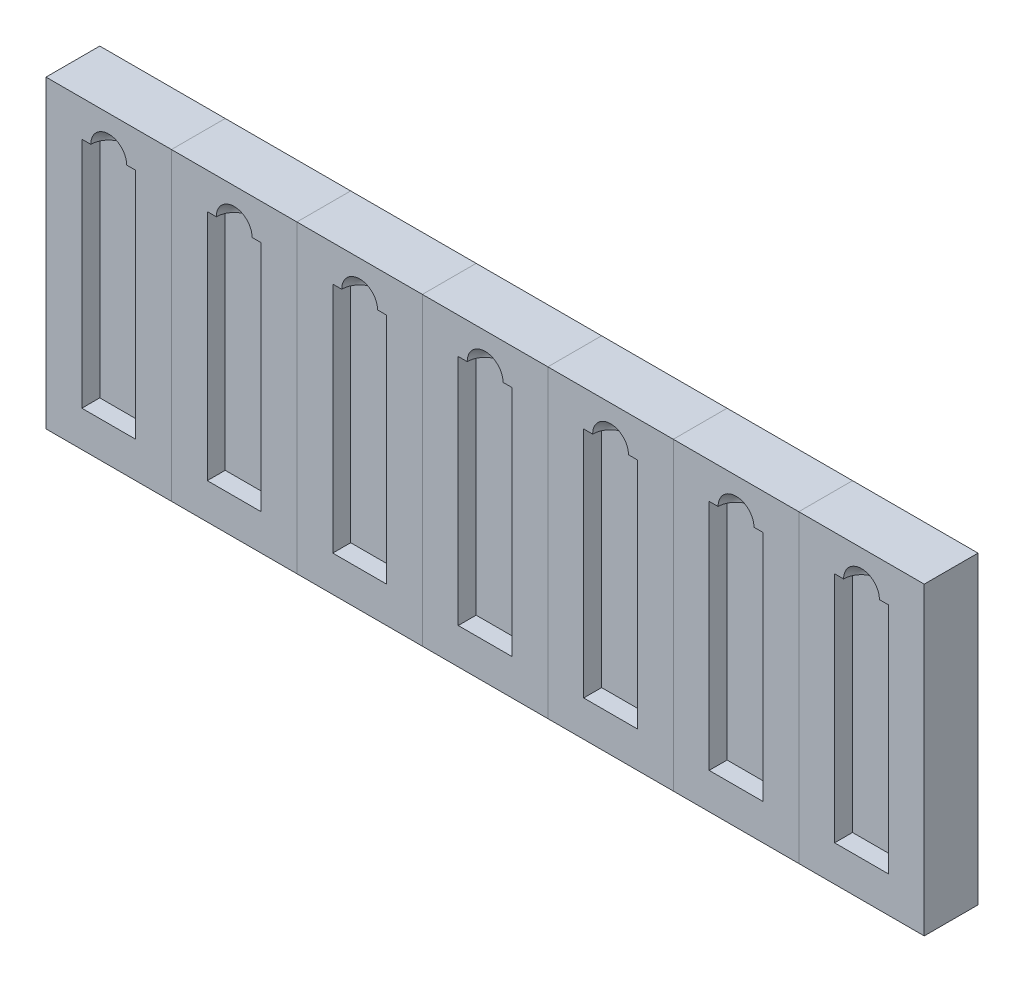
from build123d import *

# Parameters (mm, degrees)
SKETCH1_W           = 7
SKETCH1_H           = 17
BOSS_EXTRUDE1_DEPTH = 3
SHELL1_T            = -2
LPATTERN1_COUNT     = 7
LPATTERN1_PITCH     = 7


with BuildPart() as part:
    # Sketch1 → Boss-Extrude1 (new body)
    with BuildSketch(Plane.XY):
        Rectangle(SKETCH1_W, SKETCH1_H)
    extrude(amount=BOSS_EXTRUDE1_DEPTH)

    # Shell1
    shell1_openings = [part.faces().sort_by_distance(p)[0] for p in [
        (0, 0, 3),
    ]]
    offset(amount=SHELL1_T, openings=shell1_openings, kind=Kind.INTERSECTION)

    # Sketch2 → Cut-Revolve1 (revolve, cut)
    with BuildSketch(Plane.XY.offset(3)):
        with BuildLine():
            Line((-1, 6.5), (1, 6.5))
            ThreePointArc((1, 6.5), (0, 7.5), (-1, 6.5))
        make_face()
    revolve(axis=Axis((-1, 6.5, 3), (1, 0, 0)), mode=Mode.SUBTRACT)


with BuildPart() as lpattern1_1:
    # LPattern1: pattern copy
    add(part.part.moved(Location(Vector(1, 0, 0) * (1 * LPATTERN1_PITCH))))


with BuildPart() as lpattern1_2:
    # LPattern1: pattern copy
    add(part.part.moved(Location(Vector(1, 0, 0) * (2 * LPATTERN1_PITCH))))


with BuildPart() as lpattern1_3:
    # LPattern1: pattern copy
    add(part.part.moved(Location(Vector(1, 0, 0) * (3 * LPATTERN1_PITCH))))


with BuildPart() as lpattern1_4:
    # LPattern1: pattern copy
    add(part.part.moved(Location(Vector(1, 0, 0) * (4 * LPATTERN1_PITCH))))


with BuildPart() as lpattern1_5:
    # LPattern1: pattern copy
    add(part.part.moved(Location(Vector(1, 0, 0) * (5 * LPATTERN1_PITCH))))


with BuildPart() as lpattern1_6:
    # LPattern1: pattern copy
    add(part.part.moved(Location(Vector(1, 0, 0) * (6 * LPATTERN1_PITCH))))


solid = Compound([part.part, lpattern1_1.part, lpattern1_2.part, lpattern1_3.part, lpattern1_4.part, lpattern1_5.part, lpattern1_6.part])
